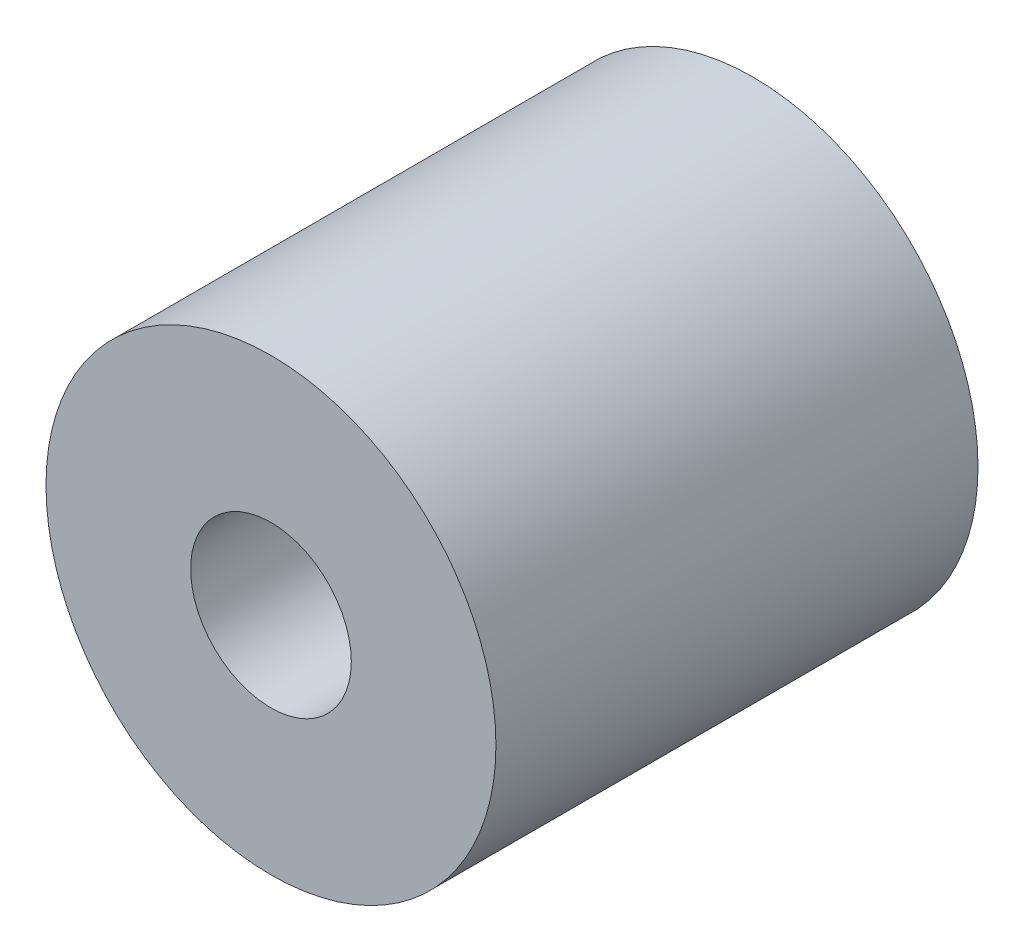
from build123d import *

# Parameters (mm, degrees)
SKETCH_1_R            = 7
FACTORY_INSERT_DEPTH  = 15
SKETCH_2_R            = 2.5
THREAD_ENVELOPE_DEPTH = 18.972200756


with BuildPart() as part:
    # 草图1 → Factory_insert (new body)
    with BuildSketch(Plane.XY):
        Circle(SKETCH_1_R)
    extrude(amount=FACTORY_INSERT_DEPTH)

    # 草图2 → Thread_envelope (cut, through all)
    with BuildSketch(Plane.XY.offset(15)):
        Circle(SKETCH_2_R)
    extrude(amount=-THREAD_ENVELOPE_DEPTH, mode=Mode.SUBTRACT)


solid = part.part
